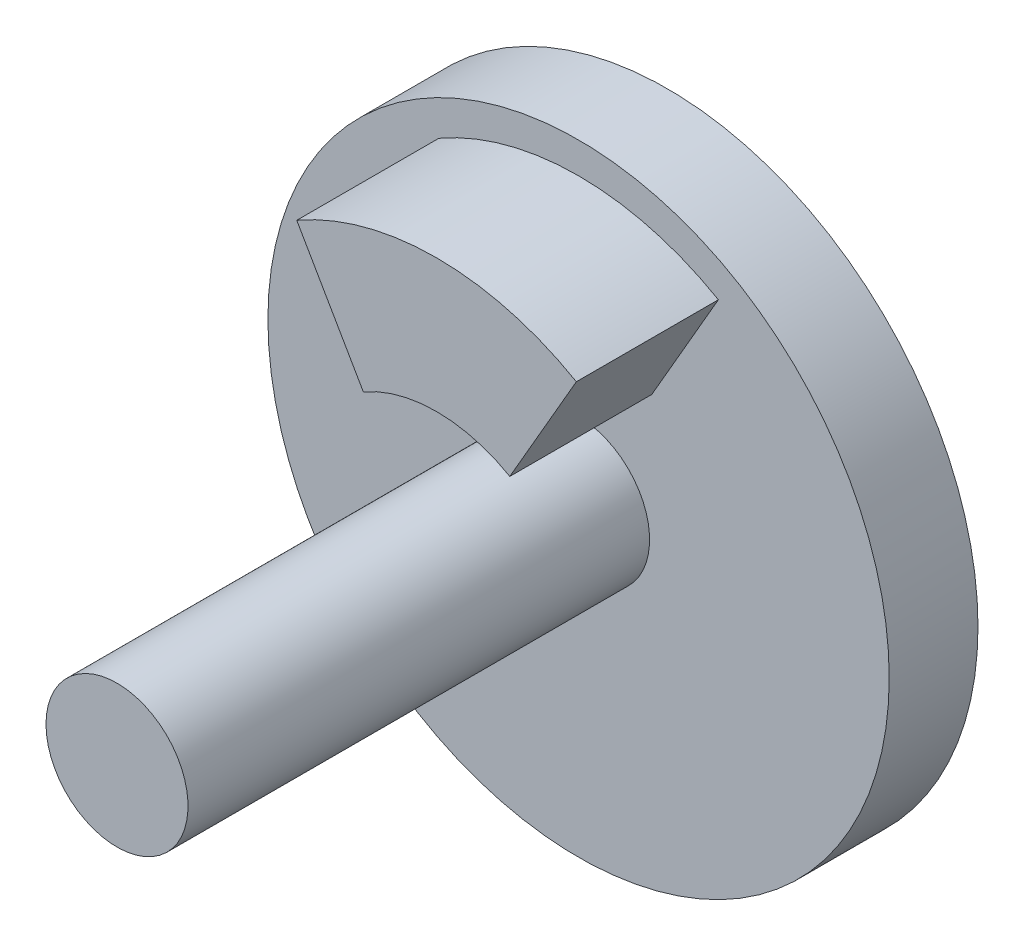
from build123d import *

# Parameters (mm, degrees)
SKETCH1_R           = 17.5
BOSS_EXTRUDE1_DEPTH = 2.5
BOSS_EXTRUDE2_DEPTH = 8
SKETCH3_R           = 4
BOSS_EXTRUDE3_DEPTH = 26
CUT_EXTRUDE1_DEPTH  = 10


with BuildPart() as part:
    # Sketch1 → Boss-Extrude1 (new, symmetric)
    with BuildSketch(Plane.XY):
        Circle(SKETCH1_R)
    extrude(amount=BOSS_EXTRUDE1_DEPTH, both=True)

    # Sketch2 → Boss-Extrude2 (add)
    with BuildSketch(Plane.XY.offset(2.5)):
        with BuildLine():
            Line((7.875, 13.63990011), (4.125, 7.144709581))
            ThreePointArc((4.125, 7.144709581), (0, 8.25), (-4.125, 7.144709581))
            Line((-4.125, 7.144709581), (-7.875, 13.63990011))
            ThreePointArc((-7.875, 13.63990011), (0, 15.75), (7.875, 13.63990011))
        make_face()
    extrude(amount=BOSS_EXTRUDE2_DEPTH)

    # Sketch3 → Boss-Extrude3 (add)
    with BuildSketch(Plane.XY.offset(2.5)):
        with Locations(Location((0, 0, 0), (0, 0, 180))):
            Circle(SKETCH3_R)
    extrude(amount=BOSS_EXTRUDE3_DEPTH)

    # Sketch4 → Cut-Extrude1 (cut)
    with BuildSketch(Plane(origin=(0, 0, -2.5), x_dir=(-1, 0, 0), z_dir=(0, 0, -1))):
        with BuildLine():
            Line((-2.385139176, 2.2), (2.385139176, 2.2))
            ThreePointArc((2.385139176, 2.2), (0, -3.24482494), (-2.385139176, 2.2))
        make_face()
    extrude(amount=-CUT_EXTRUDE1_DEPTH, mode=Mode.SUBTRACT)


solid = part.part
